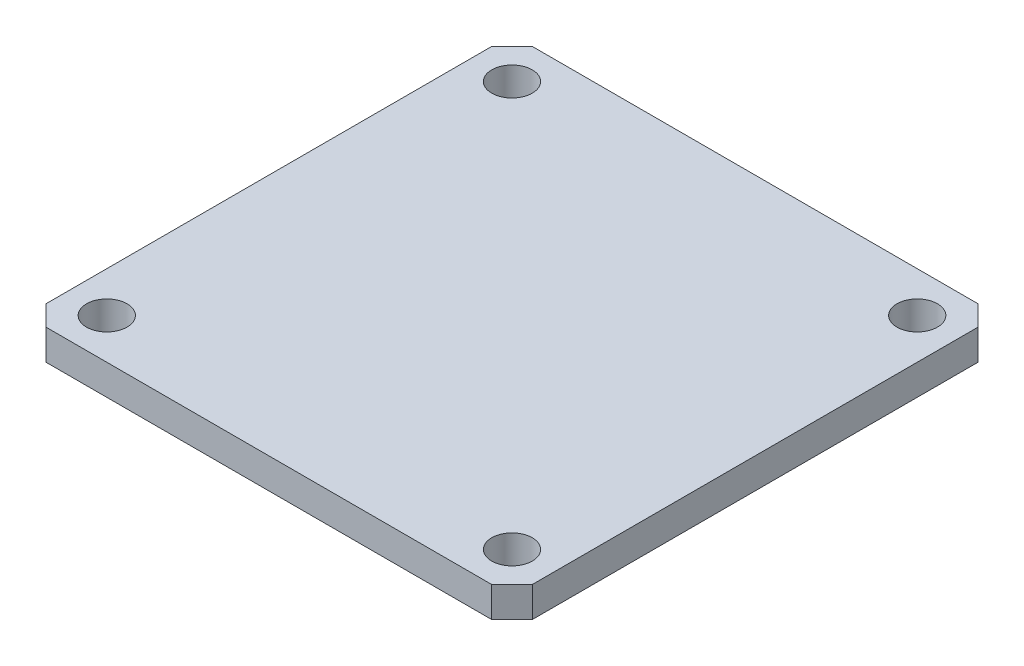
from build123d import *

# Parameters (mm, degrees)
SKETCH1_W           = 24
SKETCH1_H           = 24
BOSS_EXTRUDE1_DEPTH = 1.5
CHAMFER1_SIZE       = 1
SKETCH2_R           = 1
CUT_EXTRUDE1_DEPTH  = 1.5


with BuildPart() as part:
    # Sketch1 → Boss-Extrude1 (new body)
    with BuildSketch(Plane(origin=(0, 0, 0), x_dir=(1, 0, 0), z_dir=(0, 1, 0))):
        Rectangle(SKETCH1_W, SKETCH1_H)
    extrude(amount=BOSS_EXTRUDE1_DEPTH)

    # Chamfer1
    chamfer1_edges = [part.edges().sort_by_distance(p)[0] for p in [
        (-12, 0.75, -12),
        (12, 0.75, -12),
        (12, 0.75, 12),
        (-12, 0.75, 12),
    ]]
    chamfer(chamfer1_edges, length=CHAMFER1_SIZE)

    # Sketch2 → Cut-Extrude1 (cut)
    with BuildSketch(Plane(origin=(0, 1.5, 0), x_dir=(1, 0, 0), z_dir=(0, 1, 0))):
        with Locations(Location((-10, 10, 0), (0, 0, 270))):
            Circle(SKETCH2_R)
        with Locations(Location((10, 10, 0), (0, 0, 270))):
            Circle(SKETCH2_R)
        with Locations(Location((10, -10, 0), (0, 0, 270))):
            Circle(SKETCH2_R)
        with Locations(Location((-10, -10, 0), (0, 0, 270))):
            Circle(SKETCH2_R)
    extrude(amount=-CUT_EXTRUDE1_DEPTH, mode=Mode.SUBTRACT)


solid = part.part
